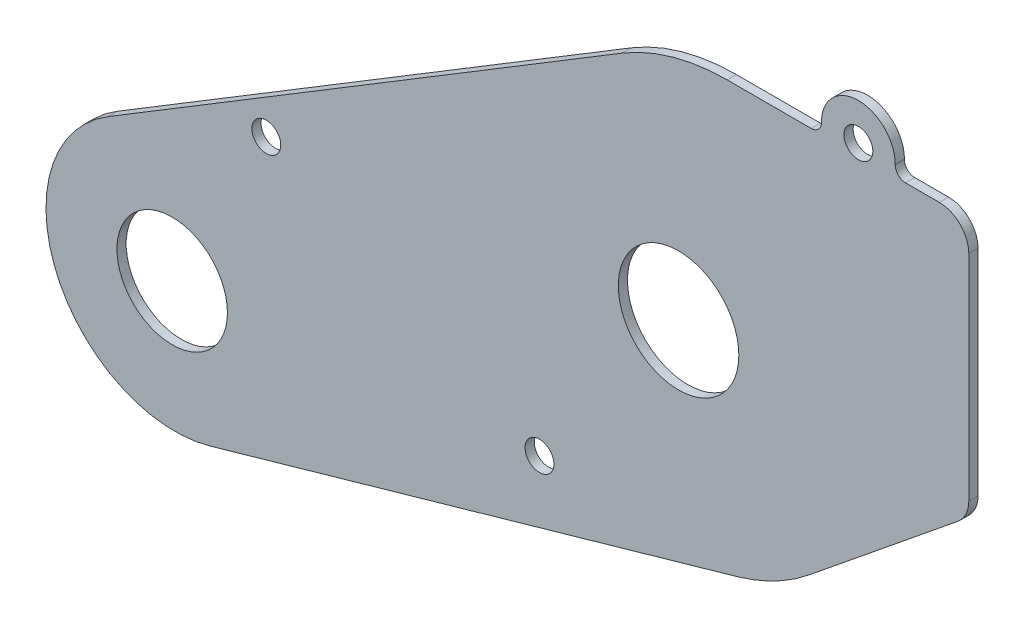
from build123d import *

# Parameters (mm, degrees)
SKETCH2_R              = 10.387693019
SKETCH2_R_2            = 9.525
BOSS_EXTRUDE1_DEPTH    = 1.5875
F_10_CLEARANCE_HOLE1_D = 4.9784


with BuildPart() as part:
    # Sketch2 → Boss-Extrude1 (new body)
    with BuildSketch(Plane.XY):
        with BuildLine():
            Line((25.091057906, -52.092444741), (-65.683756135, -78.000081372))
            ThreePointArc((-65.683756135, -78.000081372), (-92.150845981, -65.52313309), (-83.314246567, -37.628768173))
            Line((-83.314246567, -37.628768173), (5.271270971, 16.133758159))
            ThreePointArc((5.271270971, 16.133758159), (13.983534085, 19.911144202), (23.391278089, 21.202084415))
            Line((23.391278089, 21.202084415), (37.879087429, 21.202084415))
            ThreePointArc((37.879087429, 21.202084415), (39.136323286, 21.722848558), (39.657087429, 22.980084415))
            Line((39.657087429, 22.980084415), (39.657087429, 23.085322173))
            ThreePointArc((39.657087429, 23.085322173), (46.007087429, 29.435322173), (52.357087429, 23.085322173))
            Line((52.357087429, 23.085322173), (52.357087429, 22.980084415))
            ThreePointArc((52.357087429, 22.980084415), (52.877851572, 21.722848558), (54.135087429, 21.202084415))
            Line((54.135087429, 21.202084415), (59.957258632, 21.202084415))
            ThreePointArc((59.957258632, 21.202084415), (63.54936108, 19.714186863), (65.037258632, 16.122084415))
            Line((65.037258632, 16.122084415), (65.037258632, -20.861923216))
            ThreePointArc((65.037258632, -20.861923216), (64.543779313, -23.046008387), (63.159216098, -24.805762511))
            Line((63.159216098, -24.805762511), (37.51946621, -45.622378614))
            ThreePointArc((37.51946621, -45.622378614), (31.63306192, -49.487085384), (25.091057906, -52.092444741))
        make_face()
        with Locations((15.016809712, -18.883068303)):
            Circle(SKETCH2_R, mode=Mode.SUBTRACT)
        with Locations((-72.258332946, -56.628468385)):
            Circle(SKETCH2_R_2, mode=Mode.SUBTRACT)
    extrude(amount=BOSS_EXTRUDE1_DEPTH)

    # #10 Clearance Hole1 (through all)
    with Locations(Plane.XY.offset(1.5875)):
        with Locations((-56.041369259, -27.019222928), (-8.951277081, -51.090630662), (46.007087429, 23.085322173)):
            Hole(F_10_CLEARANCE_HOLE1_D / 2)


solid = part.part
